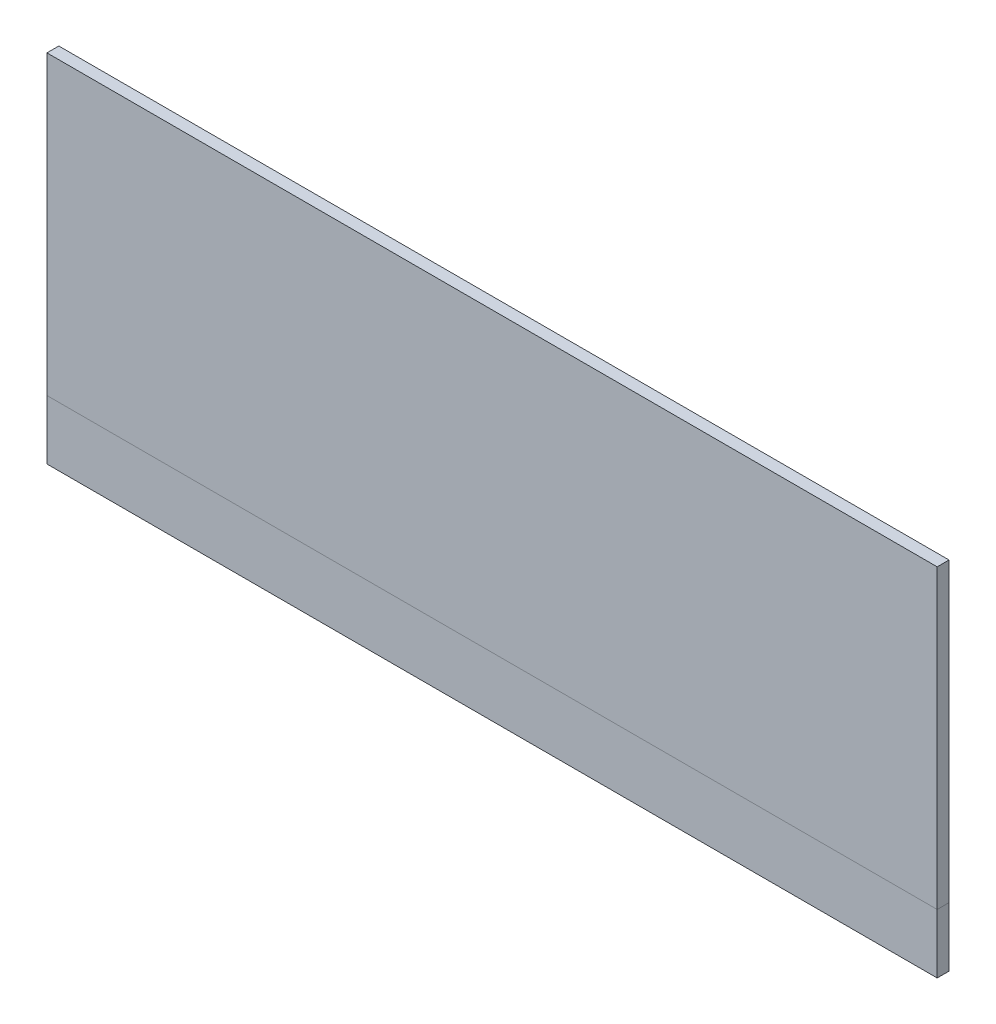
from build123d import *

# Parameters (mm, degrees)
SKETCH1_W           = 375
SKETCH1_H           = 125
BOSS_EXTRUDE1_DEPTH = 5
SKETCH2_W           = 375
SKETCH2_H           = 25
BOSS_EXTRUDE2_DEPTH = 5


with BuildPart() as part:
    # Sketch1 → Boss-Extrude1 (new body)
    with BuildSketch(Plane.XY):
        Rectangle(SKETCH1_W, SKETCH1_H)
    extrude(amount=BOSS_EXTRUDE1_DEPTH)


with BuildPart() as body_2:
    # Sketch2 → Boss-Extrude2 (new body)
    with BuildSketch(Plane.XY.offset(5)):
        with Locations((0, -75)):
            Rectangle(SKETCH2_W, SKETCH2_H)
    extrude(amount=-BOSS_EXTRUDE2_DEPTH)


solid = Compound([part.part, body_2.part])
